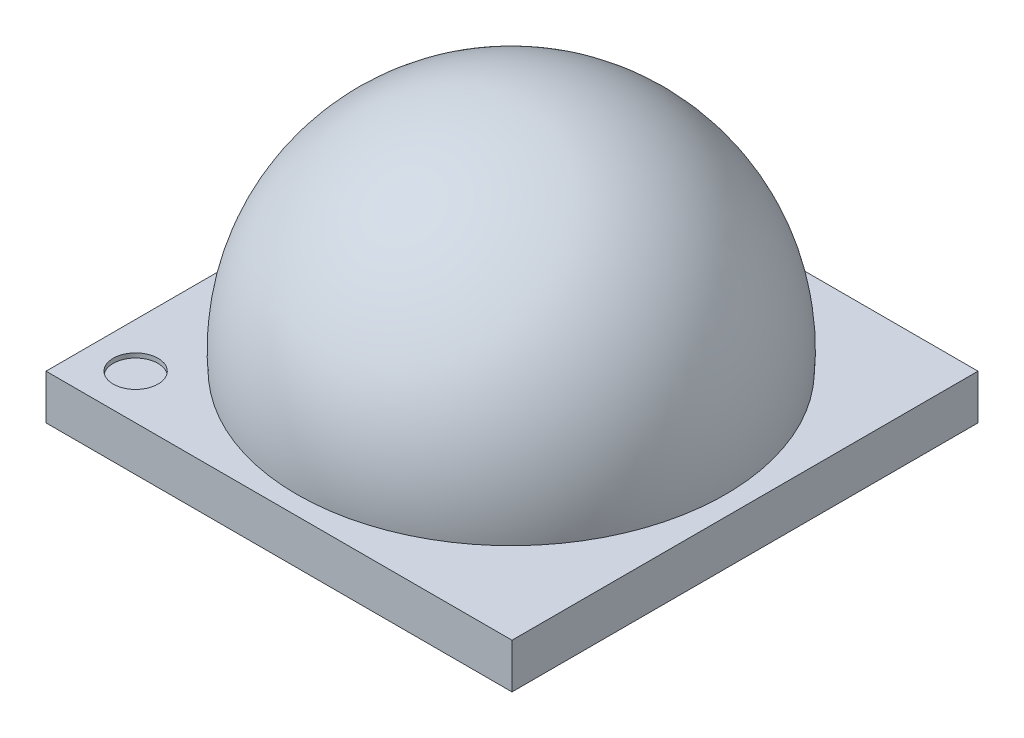
from build123d import *

# Parameters (mm, degrees)
ESQUISSE1_W             = 5.2
ESQUISSE1_H             = 5.2
BOSS_EXTRU_1_DEPTH      = 0.5
ESQUISSE1_3_W           = 1.1
ESQUISSE1_3_H           = 0.35
ESQUISSE1_3_W_2         = 0.5
ESQUISSE1_3_H_2         = 2.15
BOSS_EXTRU_2_DEPTH      = 0.025
BOSS_EXTRU_3_DEPTH      = 0.025
ESQUISSE4_3_W           = 1.15
ESQUISSE4_3_H           = 1.15
BOSS_EXTRU_4_DEPTH      = 0.1
ESQUISSE4_4_W           = 0.3
ESQUISSE4_4_H           = 1.05
ESQUISSE4_4_W_2         = 1.05
ESQUISSE4_4_H_2         = 0.3
BOSS_EXTRU_5_DEPTH      = 0.105
ESQUISSE5_R             = 0.025
ESQUISSE10_R            = 0.025
ESQUISSE12_R            = 0.25
ENL_V_MAT_EXTRU_1_DEPTH = 0.05


with BuildPart() as part:
    # Esquisse1 → Boss.-Extru.1 (new body)
    with BuildSketch(Plane(origin=(0, 0, 0), x_dir=(1, 0, 0), z_dir=(0, 1, 0))):
        Rectangle(ESQUISSE1_W, ESQUISSE1_H)
    extrude(amount=BOSS_EXTRU_1_DEPTH)

    # Esquisse1<3> → Boss.-Extru.2 (add)
    with BuildSketch(Plane(origin=(0, 0, 0), x_dir=(1, 0, 0), z_dir=(0, 1, 0))):
        with Locations((-0.85, 2.275)):
            Rectangle(ESQUISSE1_3_W, ESQUISSE1_3_H)
        with Locations((-2.15, 1.375)):
            Rectangle(ESQUISSE1_3_W_2, ESQUISSE1_3_H_2)
        with Locations((-2.15, -1.375)):
            Rectangle(ESQUISSE1_3_W_2, ESQUISSE1_3_H_2)
        with Locations((2.15, 1.375)):
            Rectangle(ESQUISSE1_3_W_2, ESQUISSE1_3_H_2)
        with Locations((0.85, 2.275)):
            Rectangle(ESQUISSE1_3_W, ESQUISSE1_3_H)
        with Locations((0.85, -2.275)):
            Rectangle(ESQUISSE1_3_W, ESQUISSE1_3_H)
        with Locations((2.15, -1.375)):
            Rectangle(ESQUISSE1_3_W_2, ESQUISSE1_3_H_2)
        Polygon((-1.4, 1.5), (-1.4, -1.8), (1.4, -1.8), (1.4, 1.8), (-1.1, 1.8), align=None)
        with Locations((-0.85, -2.275)):
            Rectangle(ESQUISSE1_3_W, ESQUISSE1_3_H)
    extrude(amount=-BOSS_EXTRU_2_DEPTH)

    # Esquisse4 → Boss.-Extru.3 (add)
    with BuildSketch(Plane(origin=(0, 0.5, 0), x_dir=(1, 0, 0), z_dir=(0, 1, 0))):
        Polygon((-0.25, 1.125), (-0.15, 1.125), (-0.15, 0.625), (-0.25, 0.625), (-0.25, 0.25), (-1.5, 0.25), (-1.5, 1.5), (-0.25, 1.5), align=None)
        Polygon((1.125, 0.25), (1.125, 0.15), (0.625, 0.15), (0.625, 0.25), (0.25, 0.25), (0.25, 1.5), (1.5, 1.5), (1.5, 0.25), align=None)
        Polygon((-1.125, -0.25), (-1.125, -0.15), (-0.625, -0.15), (-0.625, -0.25), (-0.25, -0.25), (-0.25, -1.5), (-1.5, -1.5), (-1.5, -0.25), align=None)
        Polygon((0.25, -1.125), (0.15, -1.125), (0.15, -0.625), (0.25, -0.625), (0.25, -0.25), (1.5, -0.25), (1.5, -1.5), (0.25, -1.5), align=None)
    extrude(amount=BOSS_EXTRU_3_DEPTH)

    # Esquisse4<3> → Boss.-Extru.4 (add)
    with BuildSketch(Plane(origin=(0, 0.5, 0), x_dir=(1, 0, 0), z_dir=(0, 1, 0))):
        with Locations((0.875, 0.875)):
            Rectangle(ESQUISSE4_3_W, ESQUISSE4_3_H)
        with Locations((0.875, -0.875)):
            Rectangle(ESQUISSE4_3_W, ESQUISSE4_3_H)
        with Locations((-0.875, 0.875)):
            Rectangle(ESQUISSE4_3_W, ESQUISSE4_3_H)
        with Locations((-0.875, -0.875)):
            Rectangle(ESQUISSE4_3_W, ESQUISSE4_3_H)
    extrude(amount=BOSS_EXTRU_4_DEPTH)

    # Esquisse4<4> → Boss.-Extru.5 (add)
    with BuildSketch(Plane(origin=(0, 0.5, 0), x_dir=(1, 0, 0), z_dir=(0, 1, 0))):
        with Locations((-1.25, 0.875)):
            Rectangle(ESQUISSE4_4_W, ESQUISSE4_4_H)
        with Locations((-0.890056992, 0.875)):
            Rectangle(ESQUISSE4_4_W, ESQUISSE4_4_H)
        with Locations((-0.5, 0.875)):
            Rectangle(ESQUISSE4_4_W, ESQUISSE4_4_H)
        with Locations((0.875, 1.25)):
            Rectangle(ESQUISSE4_4_W_2, ESQUISSE4_4_H_2)
        with Locations((0.875, 0.890056992)):
            Rectangle(ESQUISSE4_4_W_2, ESQUISSE4_4_H_2)
        with Locations((0.875, 0.5)):
            Rectangle(ESQUISSE4_4_W_2, ESQUISSE4_4_H_2)
        with Locations((1.25, -0.875)):
            Rectangle(ESQUISSE4_4_W, ESQUISSE4_4_H)
        with Locations((0.890056992, -0.875)):
            Rectangle(ESQUISSE4_4_W, ESQUISSE4_4_H)
        with Locations((0.5, -0.875)):
            Rectangle(ESQUISSE4_4_W, ESQUISSE4_4_H)
        with Locations((-0.875, -1.25)):
            Rectangle(ESQUISSE4_4_W_2, ESQUISSE4_4_H_2)
        with Locations((-0.875, -0.890056992)):
            Rectangle(ESQUISSE4_4_W_2, ESQUISSE4_4_H_2)
        with Locations((-0.875, -0.5)):
            Rectangle(ESQUISSE4_4_W_2, ESQUISSE4_4_H_2)
    extrude(amount=BOSS_EXTRU_5_DEPTH)

    # Balayage1: sweep along a path in Esquisse9
    with BuildLine(Plane(origin=(-0.30464, 0, -1.04448), x_dir=(-0.9600000000000009, 0, 0.27999999999999686), z_dir=(-0.2799999999999969, 0, -0.960000000000001))) as balayage1_path:
        ThreePointArc((-0.109, 0.525), (-0.386775331, 0.836286475), (-0.734, 0.605))
    # Esquisse5 → Balayage1 (sweep)
    with BuildSketch(Plane(origin=(0, 0.525, 0), x_dir=(1, 0, 0), z_dir=(0, 1, 0))):
        with Locations((-0.2, 1.075)):
            Circle(ESQUISSE5_R)
    sweep(path=balayage1_path.line)

    # Balayage2: sweep along a path in Esquisse11
    with BuildLine(Plane(origin=(0.16576, 0, -0.56832), x_dir=(-0.9600000000000003, 0, -0.2799999999999993), z_dir=(0.2799999999999993, 0, -0.9600000000000003))) as balayage2_path:
        ThreePointArc((0.380918066, 0.52483428), (0.103142735, 0.836120756), (-0.244081934, 0.60483428))
    # Esquisse10 → Balayage2 (sweep)
    with BuildSketch(Plane(origin=(0, 0.525, 0), x_dir=(1, 0, 0), z_dir=(0, 1, 0))):
        with Locations((-0.2, 0.675)):
            Circle(ESQUISSE10_R)
    sweep(path=balayage2_path.line)

    # Esquisse3 → Révolution2 (revolve)
    with BuildSketch(Plane.XY):
        with BuildLine():
            Line((0, 3.1), (-8.6969e-05, 3.075000151))
            ThreePointArc((-8.6969e-05, 3.075000151), (-1.753507247, 2.310929766), (-2.375086969, 0.502083485))
            Line((-2.375086969, 0.502083485), (-2.375086969, 0.5))
            Line((-2.375086969, 0.5), (-2.4, 0.5))
            ThreePointArc((-2.4, 0.5), (-1.771877333, 2.327886769), (0, 3.1))
        make_face()
    revolve(axis=Axis((0, 3.1, 0), (-0.0034787774337874176, -0.999993949035476, 0)))

    # Esquisse12 → Enlèv. mat.-Extru.1 (cut)
    with BuildSketch(Plane(origin=(0, 0.5, 0), x_dir=(1, 0, 0), z_dir=(0, 1, 0))):
        with Locations((-2.1, -2.1)):
            Circle(ESQUISSE12_R)
    extrude(amount=-ENL_V_MAT_EXTRU_1_DEPTH, mode=Mode.SUBTRACT)


solid = part.part
